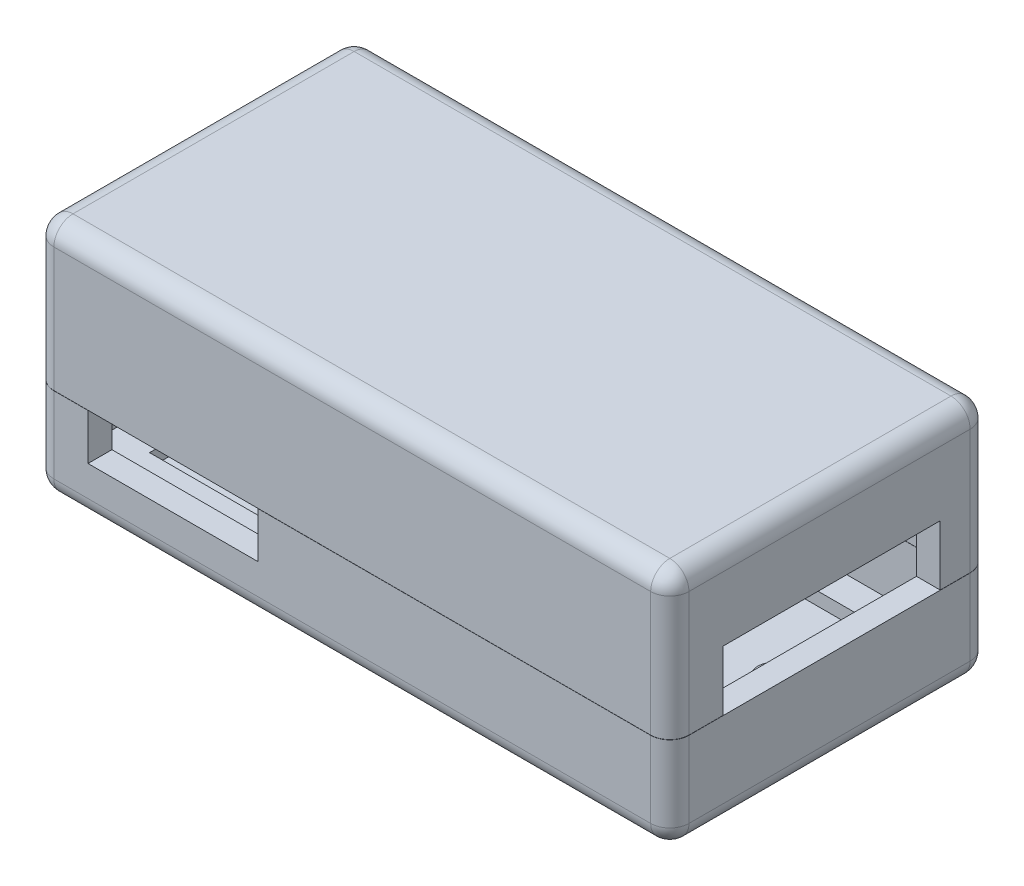
from build123d import *

# Parameters (mm, degrees)
SKETCH1_W           = 84.328
SKETCH1_H           = 42.418
BOSS_EXTRUDE1_DEPTH = 31.75
SKETCH2_W           = 22.5679
SKETCH2_H           = 6.09854
CUT_EXTRUDE1_DEPTH  = 68.713751336
SHELL1_T            = -3.175
CUT_EXTRUDE3_REACH  = 94.569
SKETCH4_W           = 7.874
SKETCH4_H           = 6.09854
FILLET1_R           = 2.54
SKETCH5_W           = 89.038189856
SKETCH5_H           = 0.0254
CUT_EXTRUDE4_DEPTH  = 68.713751336
SKETCH6_W           = 77.978
SKETCH6_H           = 36.068
BOSS_EXTRUDE2_DEPTH = 1.75006
SKETCH7_R           = 2.286
BOSS_EXTRUDE3_DEPTH = 1.6002
SKETCH9_W           = 28.870221249
SKETCH9_H           = 7.968851024
CUT_EXTRUDE5_DEPTH  = 3.175


with BuildPart() as part:
    # Sketch1 → Boss-Extrude1 (new body)
    with BuildSketch(Plane(origin=(0, 0, 0), x_dir=(1, 0, 0), z_dir=(0, 1, 0))):
        Rectangle(SKETCH1_W, SKETCH1_H)
    extrude(amount=BOSS_EXTRUDE1_DEPTH)

    # Sketch2 → Cut-Extrude1 (cut, through all)
    with BuildSketch(Plane.XY.offset(21.209)):
        with Locations((-23.80615, 9.62533)):
            Rectangle(SKETCH2_W, SKETCH2_H)
    extrude(amount=-CUT_EXTRUDE1_DEPTH, mode=Mode.SUBTRACT)

    # Shell1
    shell1_openings = [part.faces().sort_by_distance(p)[0] for p in [
        (-35.0901, 9.62533, 0),
        (-23.80615, 12.6746, 0),
        (-12.5222, 9.62533, 0),
        (-23.80615, 6.57606, 0),
    ]]
    offset(amount=SHELL1_T, openings=shell1_openings, kind=Kind.INTERSECTION)

    # Sketch4 → Cut-Extrude3 (cut, up to next)
    with BuildSketch(Plane.ZY.offset(42.164), mode=Mode.PRIVATE) as cut_extrude3_sk1:
        with Locations((0, 9.62533)):
            Rectangle(SKETCH4_W, SKETCH4_H)
    cut_extrude3_tool1 = extrude(cut_extrude3_sk1.sketch, amount=-CUT_EXTRUDE3_REACH, mode=Mode.PRIVATE) & part.part
    add(cut_extrude3_tool1.solids().sort_by_distance((-42.164, 9.62533, 0))[0], mode=Mode.SUBTRACT)

    # Fillet1
    fillet1_edges = [part.edges().sort_by_distance(p)[0] for p in [
        (0, 31.75, -21.209),
        (-42.164, 31.75, 0),
        (0, 31.75, 21.209),
        (-42.164, 0, 0),
        (0, 0, -21.209),
        (42.164, 0, 0),
        (0, 0, 21.209),
        (-42.164, 15.875, 21.209),
        (-42.164, 15.875, -21.209),
        (42.164, 15.875, -21.209),
        (42.164, 15.875, 21.209),
        (42.164, 31.75, 0),
    ]]
    fillet(fillet1_edges, radius=FILLET1_R)

    # Sketch5 → Cut-Extrude4 (cut, through all)
    with BuildSketch(Plane.XY.offset(21.209)):
        with Locations((0.216743403, 12.6873)):
            Rectangle(SKETCH5_W, SKETCH5_H)
    extrude(amount=-CUT_EXTRUDE4_DEPTH, mode=Mode.SUBTRACT)


with BuildPart() as cut_extrude4_piece_1:
    # of the separate pieces the step leaves, piece 1, a body of its own (cut_extrude4_pieces)
    add(part.part.solids().sort_by_distance((-39.624, 12.7, 21.209))[0])

    # Sketch9 → Cut-Extrude5 (cut)
    with BuildSketch(Plane(origin=(42.164, 0, 0), x_dir=(0, 0, -1), z_dir=(1, 0, 0))):
        with Locations((0.260092084, 16.684425512)):
            Rectangle(SKETCH9_W, SKETCH9_H)
    extrude(amount=-CUT_EXTRUDE5_DEPTH, mode=Mode.SUBTRACT)


with BuildPart() as cut_extrude4_piece_2:
    # of the separate pieces the step leaves, piece 2, a body of its own (cut_extrude4_pieces)
    add(part.part.solids().sort_by_distance((-39.624, 2.54, 21.209))[0])

    # Sketch6 → Boss-Extrude2 (add)
    with BuildSketch(Plane(origin=(0, 3.175, 0), x_dir=(1, 0, 0), z_dir=(0, 1, 0))):
        Rectangle(SKETCH6_W, SKETCH6_H)
        Polygon((-33.909, -14.224), (-33.909, 14.224), (35.179, 14.224), (35.179, 6.35), (31.623, 6.35), (31.623, -6.35), (35.179, -6.35), (35.179, -14.224), align=None, mode=Mode.SUBTRACT)
    extrude(amount=BOSS_EXTRUDE2_DEPTH)

    # Sketch7 → Boss-Extrude3 (add)
    with BuildSketch(Plane(origin=(0, 4.92506, 0), x_dir=(1, 0, 0), z_dir=(0, 1, 0))):
        with Locations(Location((34.925, 0, 0), (0, 0, 90))):
            Circle(SKETCH7_R)
    extrude(amount=BOSS_EXTRUDE3_DEPTH)


solid = Compound([cut_extrude4_piece_1.part, cut_extrude4_piece_2.part])
